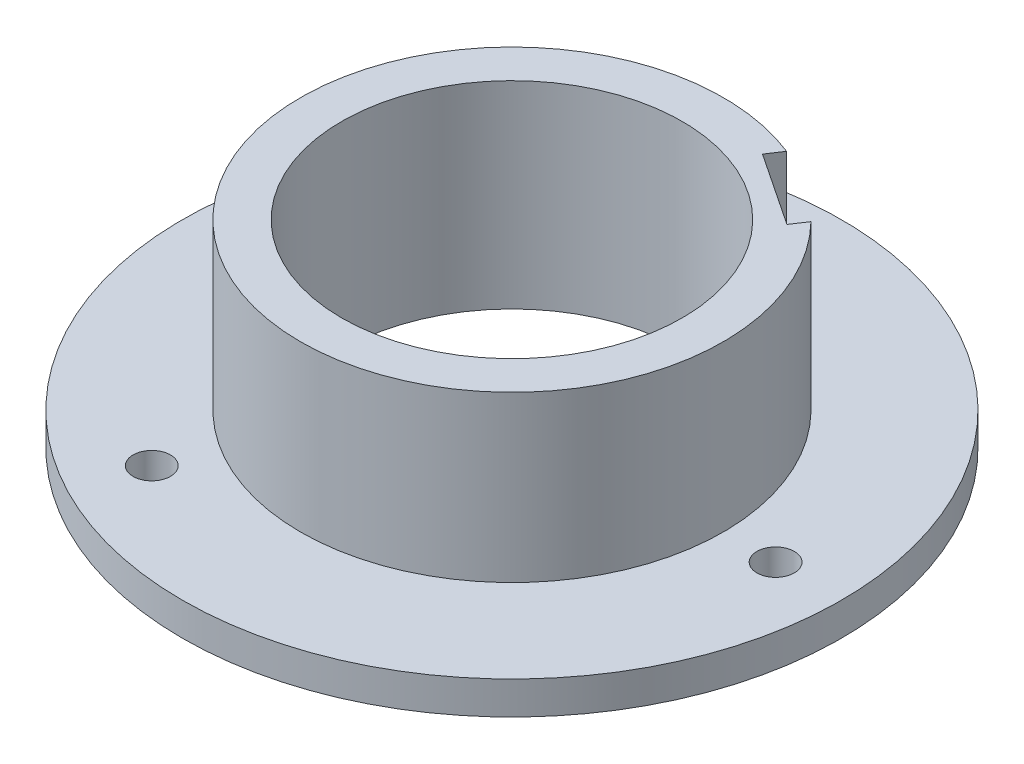
from build123d import *

# Parameters (mm, degrees)
SKETCH2_R          = 30
SKETCH2_R_2        = 19.25
FLANG_DEPTH        = 3
SKETCH2_3_R        = 19.25
SKETCH2_3_R_2      = 15.5
SKIRT_DEPTH        = 18
SKETCH3_R          = 1.7
HOLES_BOLTS_DEPTH  = 46
SERVICE_SLOT_DEPTH = 46


with BuildPart() as part:
    # Sketch2 → flang (new body)
    with BuildSketch(Plane(origin=(0, 0, 0), x_dir=(1, 0, 0), z_dir=(0, 1, 0))):
        Circle(SKETCH2_R)
        Circle(SKETCH2_R_2, mode=Mode.SUBTRACT)
    extrude(amount=FLANG_DEPTH)

    # Sketch2<3> → skirt (add)
    with BuildSketch(Plane(origin=(0, 0, 0), x_dir=(1, 0, 0), z_dir=(0, 1, 0))):
        Circle(SKETCH2_3_R)
        Circle(SKETCH2_3_R_2, mode=Mode.SUBTRACT)
    extrude(amount=SKIRT_DEPTH)

    # Sketch3 → holes_bolts (cut, through all)
    with BuildSketch(Plane(origin=(0, 3, 0), x_dir=(1, 0, 0), z_dir=(0, 1, 0))):
        with Locations((24, 0)):
            Circle(SKETCH3_R)
        with Locations((-12, -20.784609691)):
            Circle(SKETCH3_R)
        with Locations((-12, 20.784609691)):
            Circle(SKETCH3_R)
    extrude(amount=-HOLES_BOLTS_DEPTH, mode=Mode.SUBTRACT)

    # Sketch8 → service_slot (cut, through all)
    with BuildSketch(Plane(origin=(0, 3, 0), x_dir=(1, 0, 0), z_dir=(0, 1, 0))):
        Polygon((14.000367572, 13.804064903), (7.342096898, 18.238862715), (6.233397445, 16.574295047), (12.891668119, 12.139497235), align=None)
    extrude(amount=SERVICE_SLOT_DEPTH, mode=Mode.SUBTRACT)


solid = part.part
